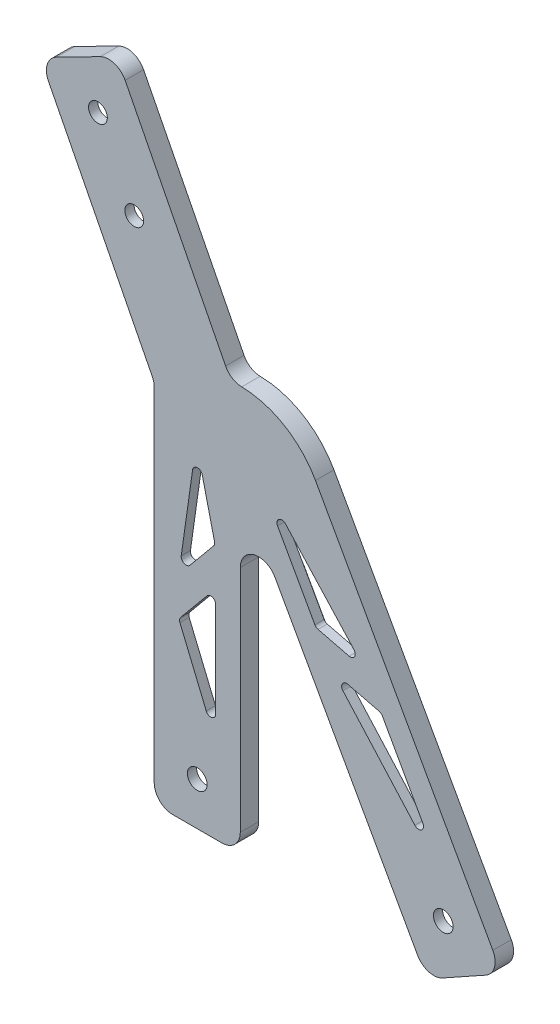
from build123d import *

# Parameters (mm, degrees)
SCHIZZO2_R                   = 1.6
SCHIZZO2_R_2                 = 1.525
ESTRUSIONE_ESTRUSIONE1_DEPTH = 1.5
RACCORDO1_R                  = 3
TAGLIO_ESTRUSIONE1_DEPTH     = 161.918381387
ESTRUSIONE_ESTRUSIONE2_DEPTH = 1.5
RACCORDO2_R                  = 0.8


with BuildPart() as part:
    # Schizzo2 → Estrusione-Estrusione1 (new body)
    with BuildSketch(Plane.XY):
        with BuildLine():
            Line((10.835450111, 45.456844872), (10.835450111, 104.878132603))
            Line((10.835450111, 104.878132603), (-7.726239407, 141.30749945))
            Line((-7.726239407, 141.30749945), (4.747851932, 147.663366447))
            Line((4.747851932, 147.663366447), (23.319883285, 111.213702604))
            ThreePointArc((23.319883285, 111.213702604), (31.262689996, 109.733445118), (37.064853942, 104.110791454))
            Line((37.064853942, 104.110791454), (67.357558736, 49.749549666))
            Line((67.357558736, 49.749549666), (55.128154906, 42.934736247))
            Line((55.128154906, 42.934736247), (24.835450111, 97.295978034))
            Line((24.835450111, 97.295978034), (24.835450111, 45.456844872))
            Line((24.835450111, 45.456844872), (10.835450111, 45.456844872))
        make_face()
        with Locations((17.835450111, 52.456844872)):
            Circle(SCHIZZO2_R, mode=Mode.SUBTRACT)
        with Locations((57.835450111, 52.456844872)):
            Circle(SCHIZZO2_R, mode=Mode.SUBTRACT)
        with Locations((1.688739761, 138.248387279)):
            Circle(SCHIZZO2_R_2, mode=Mode.SUBTRACT)
        with Locations((7.590616257, 126.665302465)):
            Circle(SCHIZZO2_R_2, mode=Mode.SUBTRACT)
    extrude(amount=ESTRUSIONE_ESTRUSIONE1_DEPTH)

    # Raccordo1
    raccordo1_edges = [part.edges().sort_by_distance(p)[0] for p in [
        (10.835450111, 45.456844872, 0.75),
        (10.835450111, 104.878132603, 0.75),
        (-7.726239407, 141.30749945, 0.75),
        (4.747851932, 147.663366447, 0.75),
        (23.319883285, 111.213702604, 0.75),
        (67.357558736, 49.749549666, 0.75),
        (55.128154906, 42.934736247, 0.75),
        (24.835450111, 97.295978034, 0.75),
        (24.835450111, 45.456844872, 0.75),
    ]]
    fillet(raccordo1_edges, radius=RACCORDO1_R)

    # Schizzo3 → Taglio-Estrusione1 (cut, through all)
    with BuildSketch(Plane(origin=(0, 0, 0), x_dir=(-1, 0, 0), z_dir=(0, 0, -1))):
        Polygon((-58.032865762, 58.26562082), (-47.760114135, 76.700406977), (-39.799110822, 78.660596286), align=None)
        Polygon((-45.099489196, 81.47498477), (-37.138485884, 83.435174078), (-27.576187875, 100.595028163), align=None)
        Polygon((-14.835450111, 73.513329832), (-20.835450111, 59.080649935), (-20.835450111, 80.754828538), align=None)
        Polygon((-20.736858212, 86.90531457), (-17.675265193, 99.811833972), (-14.835450111, 79.782808049), align=None)
    extrude(amount=-TAGLIO_ESTRUSIONE1_DEPTH, mode=Mode.SUBTRACT)

    # Schizzo4 → Estrusione-Estrusione2 (add)
    with BuildSketch(Plane(origin=(0, 0, 0), x_dir=(-1, 0, 0), z_dir=(0, 0, -1))):
        with BuildLine():
            Line((5.053219834, 142.669470949), (-2.074832359, 146.301394947))
            ThreePointArc((-2.074832359, 146.301394947), (-4.363854842, 146.481544924), (-6.109823431, 144.990346874))
            Line((-6.109823431, 144.990346874), (-22.444537387, 112.93166566))
            ThreePointArc((-22.444537387, 112.93166566), (-23.528890764, 111.74881109), (-25.067773398, 111.294050255))
            ThreePointArc((-25.067773398, 111.294050255), (-32.027352671, 109.307494906), (-37.064853942, 104.110791454))
            Line((-37.064853942, 104.110791454), (-65.897241575, 52.370136202))
            ThreePointArc((-65.897241575, 52.370136202), (-66.162289717, 50.089384698), (-64.736972201, 48.289232505))
            Line((-64.736972201, 48.289232505), (-57.748741441, 44.395053408))
            ThreePointArc((-57.748741441, 44.395053408), (-55.467989937, 44.130005266), (-53.667837744, 45.555322782))
            Line((-53.667837744, 45.555322782), (-30.456036646, 87.209653102))
            ThreePointArc((-30.456036646, 87.209653102), (-27.081049556, 88.652933675), (-24.835450111, 85.749335941))
            Line((-24.835450111, 85.749335941), (-24.835450111, 48.456844872))
            ThreePointArc((-24.835450111, 48.456844872), (-23.956770454, 46.335524528), (-21.835450111, 45.456844872))
            Line((-21.835450111, 45.456844872), (-13.835450111, 45.456844872))
            ThreePointArc((-13.835450111, 45.456844872), (-11.714129767, 46.335524528), (-10.835450111, 48.456844872))
            Line((-10.835450111, 48.456844872), (-10.835450111, 104.157896326))
            ThreePointArc((-10.835450111, 104.157896326), (-10.752559872, 104.858232417), (-10.508469683, 105.519867825))
            Line((-10.508469683, 105.519867825), (6.364267908, 138.634479878))
            ThreePointArc((6.364267908, 138.634479878), (6.544417884, 140.92350236), (5.053219834, 142.669470949))
        make_face()
        with BuildLine():
            Line((-35.317796251, 103.13724668), (-64.150183885, 51.396591427))
            ThreePointArc((-64.150183885, 51.396591427), (-64.238533265, 50.636340926), (-63.763427427, 50.036290195))
            Line((-63.763427427, 50.036290195), (-56.775196666, 46.142111098))
            ThreePointArc((-56.775196666, 46.142111098), (-56.014946165, 46.053761717), (-55.414895434, 46.528867556))
            Line((-55.414895434, 46.528867556), (-32.203094336, 88.183197876))
            ThreePointArc((-32.203094336, 88.183197876), (-26.578115853, 90.588665498), (-22.835450111, 85.749335941))
            Line((-22.835450111, 85.749335941), (-22.835450111, 48.456844872))
            ThreePointArc((-22.835450111, 48.456844872), (-22.542556892, 47.749738091), (-21.835450111, 47.456844872))
            Line((-21.835450111, 47.456844872), (-13.835450111, 47.456844872))
            ThreePointArc((-13.835450111, 47.456844872), (-13.12834333, 47.749738091), (-12.835450111, 48.456844872))
            Line((-12.835450111, 48.456844872), (-12.835450111, 104.157896326))
            ThreePointArc((-12.835450111, 104.157896326), (-12.697299713, 105.325123145), (-12.290482732, 106.427848824))
            Line((-12.290482732, 106.427848824), (4.582254859, 139.542460877))
            ThreePointArc((4.582254859, 139.542460877), (4.642304851, 140.305468371), (4.145238835, 140.887457901))
            Line((4.145238835, 140.887457901), (-2.982813359, 144.519381899))
            ThreePointArc((-2.982813359, 144.519381899), (-3.745820853, 144.579431891), (-4.327810383, 144.082365875))
            Line((-4.327810383, 144.082365875), (-20.662524339, 112.02368466))
            ThreePointArc((-20.662524339, 112.02368466), (-22.469779967, 110.052260378), (-25.034584357, 109.294325652))
            ThreePointArc((-25.034584357, 109.294325652), (-30.99993802, 107.591563924), (-35.317796251, 103.13724668))
        make_face(mode=Mode.SUBTRACT)
    extrude(amount=ESTRUSIONE_ESTRUSIONE2_DEPTH)

    # Raccordo2
    raccordo2_edges = [part.edges().sort_by_distance(p)[0] for p in [
        (39.799110822, 78.660596286, 0.75),
        (58.032865762, 58.26562082, 0.75),
        (47.760114135, 76.700406977, 0.75),
        (45.099489196, 81.47498477, 0.75),
        (27.576187875, 100.595028163, 0.75),
        (37.138485884, 83.435174078, 0.75),
        (20.835450111, 80.754828538, 0.75),
        (14.835450111, 73.513329832, 0.75),
        (20.835450111, 59.080649935, 0.75),
        (14.835450111, 79.782808049, 0.75),
        (20.736858212, 86.90531457, 0.75),
        (17.675265193, 99.811833972, 0.75),
    ]]
    fillet(raccordo2_edges, radius=RACCORDO2_R)


solid = part.part
